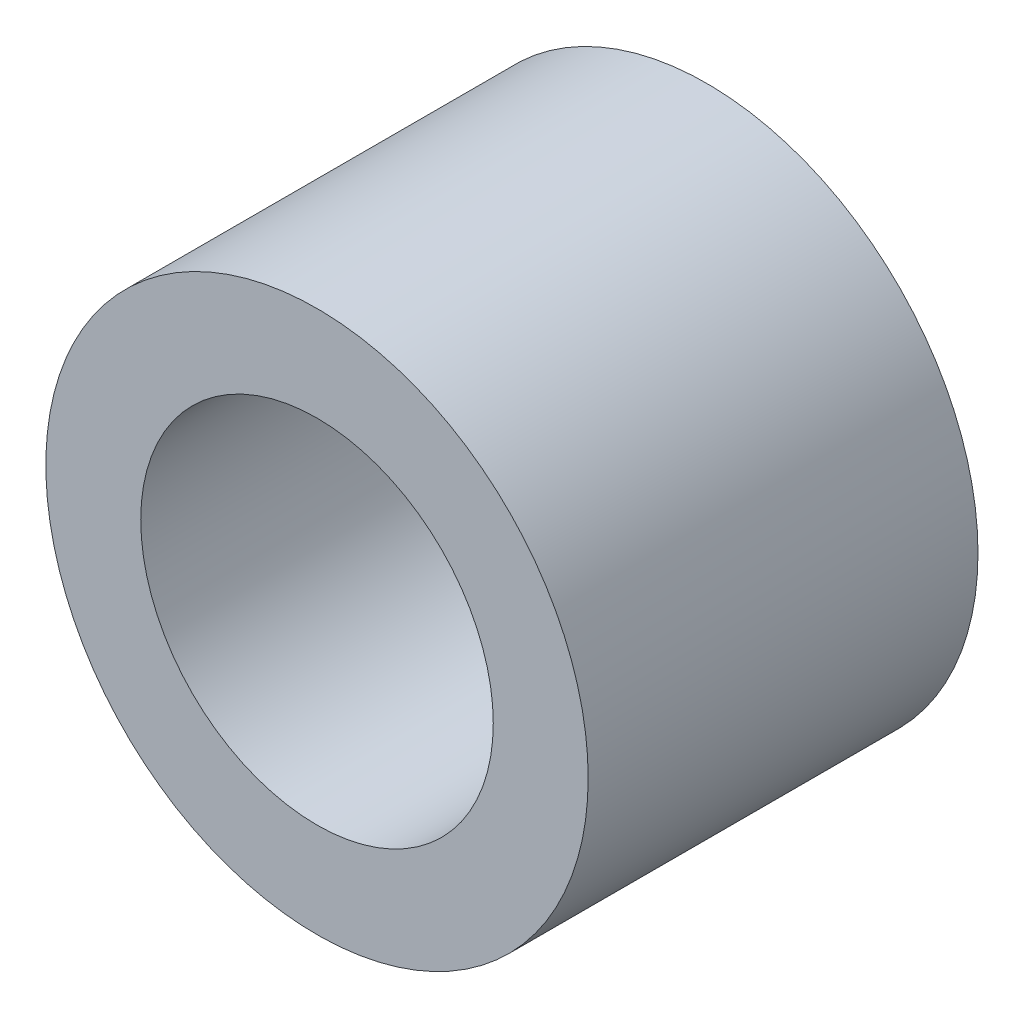
from build123d import *

# Parameters (mm, degrees)
SKETCH_1_R      = 4
SKETCH_1_R_2    = 2.6
EXTRUDE_1_DEPTH = 5.75


with BuildPart() as part:
    # 草图1 → 凸台-拉伸1 (new body)
    with BuildSketch(Plane.XY):
        Circle(SKETCH_1_R)
        Circle(SKETCH_1_R_2, mode=Mode.SUBTRACT)
    extrude(amount=EXTRUDE_1_DEPTH)


solid = part.part
